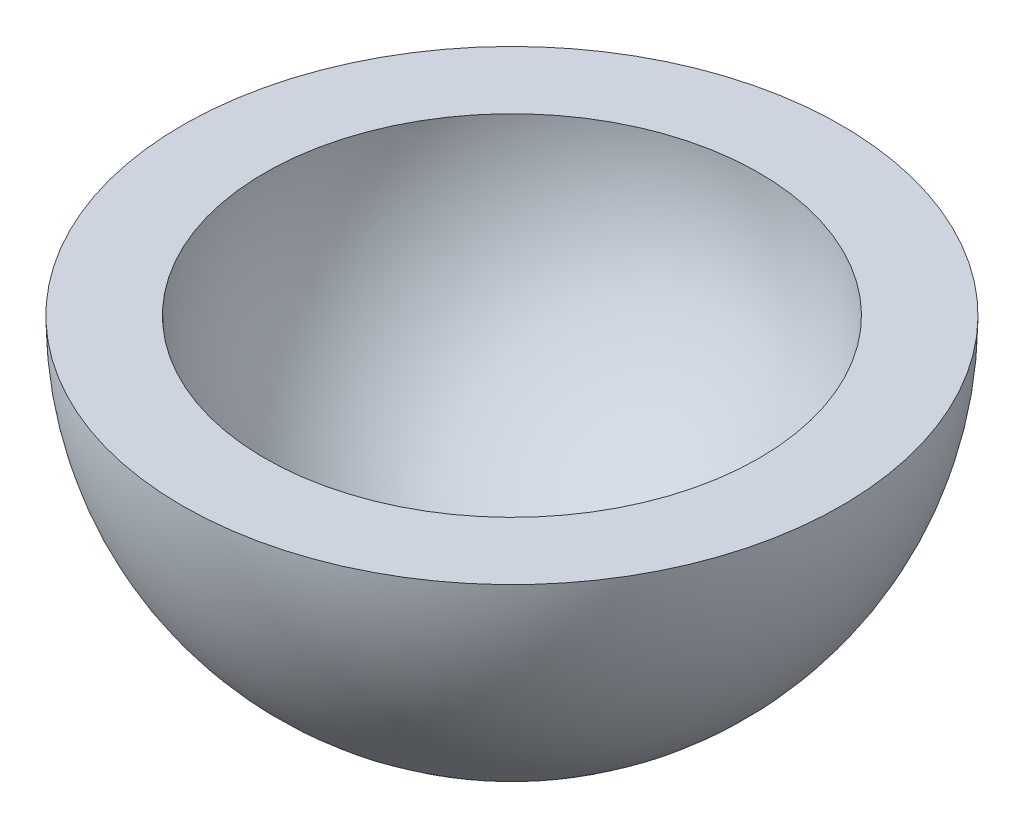
from build123d import *

# Parameters (mm, degrees)
REVOLVE1_ANGLE = 180


with BuildPart() as part:
    # Sketch1 → Revolve1 (revolve)
    with BuildSketch(Plane(origin=(0, 0, 0), x_dir=(1, 0, 0), z_dir=(0, 1, 0))):
        with BuildLine():
            Line((0, 8), (0, -8))
            ThreePointArc((0, -8), (-8, 0), (0, 8))
        make_face()
    revolve(axis=Axis((0, 0, -8), (0, 0, 1)), revolution_arc=REVOLVE1_ANGLE)

    # Sketch2 → Cut-Revolve1 (revolve, cut)
    with BuildSketch(Plane(origin=(0, 0, 0), x_dir=(1, 0, 0), z_dir=(0, 1, 0))):
        with BuildLine():
            Line((0, 6), (0, -6))
            ThreePointArc((0, -6), (-6, 0), (0, 6))
        make_face()
    revolve(axis=Axis((0, 0, -6), (0, 0, 1)), mode=Mode.SUBTRACT)


solid = part.part
